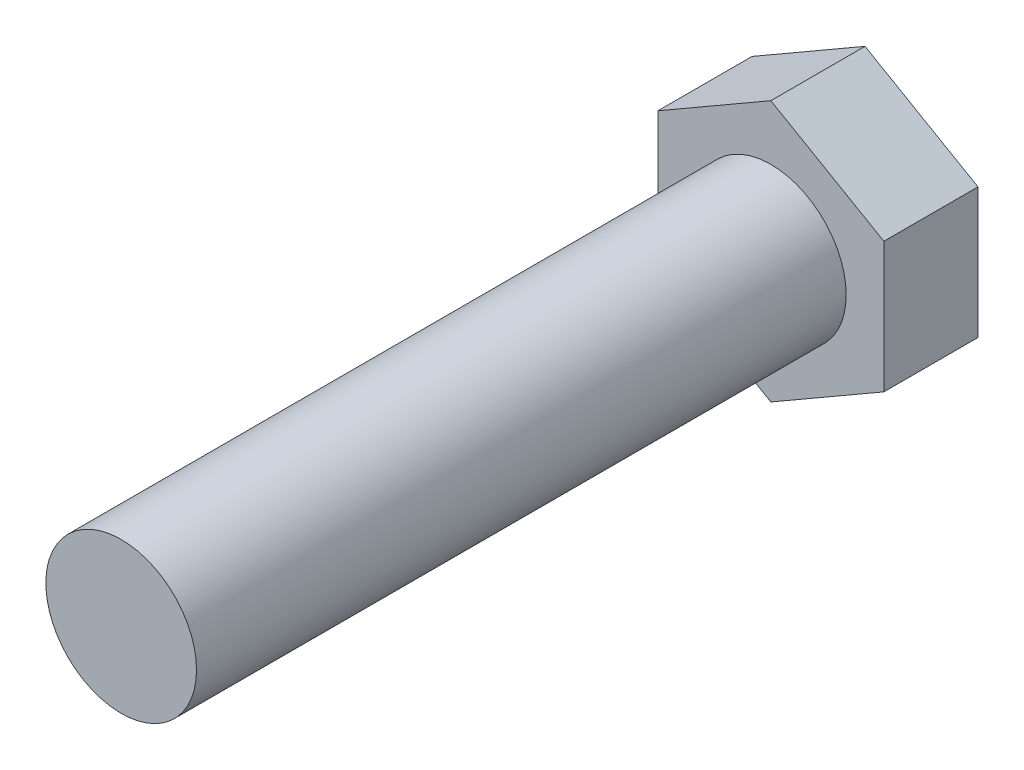
from build123d import *

# Parameters (mm, degrees)
BOSS_EXTRUDE1_DEPTH = 5
SKETCH2_R           = 4
BOSS_EXTRUDE2_DEPTH = 34.5


with BuildPart() as part:
    # Sketch1 → Boss-Extrude1 (new body)
    with BuildSketch(Plane.XY):
        Polygon((0, 6.92820323), (-6, 3.464101615), (-6, -3.464101615), (0, -6.92820323), (6, -3.464101615), (6, 3.464101615), align=None)
    extrude(amount=BOSS_EXTRUDE1_DEPTH)

    # Sketch2 → Boss-Extrude2 (add)
    with BuildSketch(Plane.XY.offset(5)):
        Circle(SKETCH2_R)
    extrude(amount=BOSS_EXTRUDE2_DEPTH)


solid = part.part
